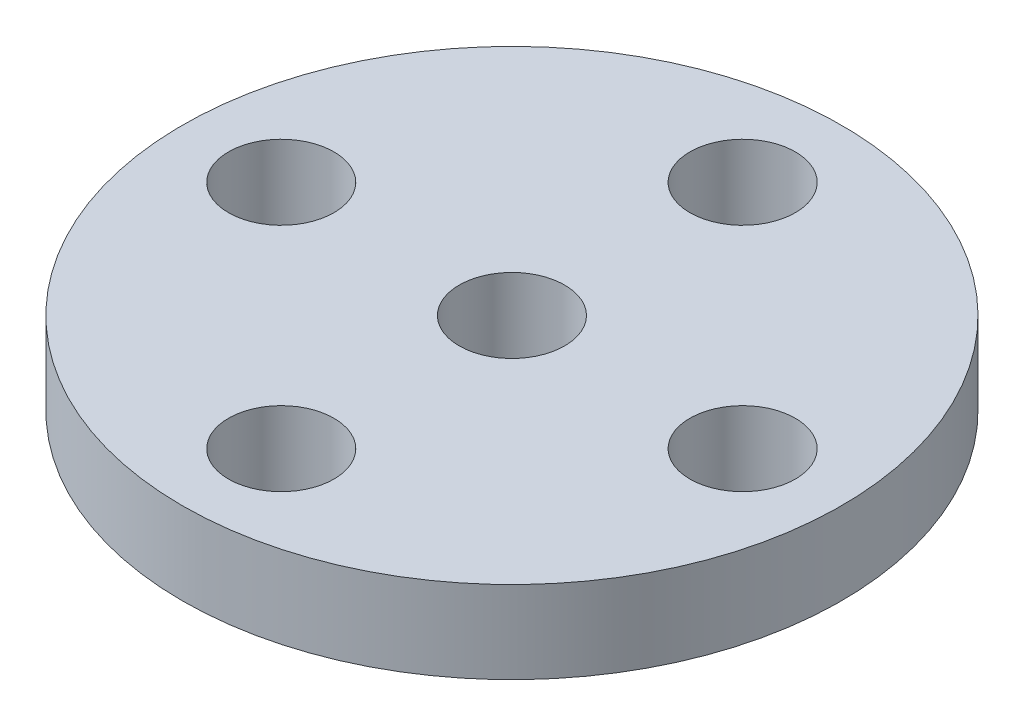
from build123d import *

# Parameters (mm, degrees)
SKETCH_1_R          = 4
EXTRUDE_1_DEPTH     = 2
SKETCH_2_R          = 10
EXTRUDE_2_DEPTH     = 2.5
SKETCH_3_R          = 1.6
CUT_EXTRUDE_1_DEPTH = 15.84082208


with BuildPart() as part:
    # 草图1 → 凸台-拉伸1 (new body)
    with BuildSketch(Plane(origin=(0, 0, 0), x_dir=(1, 0, 0), z_dir=(0, 1, 0))):
        with Locations(Location((0, 0, 0), (0, 0, 270))):
            Circle(SKETCH_1_R)
    extrude(amount=EXTRUDE_1_DEPTH)

    # 草图2 → 凸台-拉伸2 (add)
    with BuildSketch(Plane(origin=(0, 2, 0), x_dir=(1, 0, 0), z_dir=(0, 1, 0))):
        with Locations(Location((0, 0, 0), (0, 0, 270))):
            Circle(SKETCH_2_R)
    extrude(amount=EXTRUDE_2_DEPTH)

    # 草图3 → 切除-拉伸1 (cut, through all)
    with BuildSketch(Plane(origin=(0, 4.5, 0), x_dir=(1, 0, 0), z_dir=(0, 1, 0))):
        with Locations(Location((0, 0, 0), (0, 0, 270))):
            Circle(SKETCH_3_R)
        with Locations(Location((0, 7, 0), (0, 0, 270))):
            Circle(SKETCH_3_R)
        with Locations(Location((7, 0, 0), (0, 0, 270))):
            Circle(SKETCH_3_R)
        with Locations(Location((0, -7, 0), (0, 0, 270))):
            Circle(SKETCH_3_R)
        with Locations(Location((-7, 0, 0), (0, 0, 270))):
            Circle(SKETCH_3_R)
    extrude(amount=-CUT_EXTRUDE_1_DEPTH, mode=Mode.SUBTRACT)


solid = part.part
